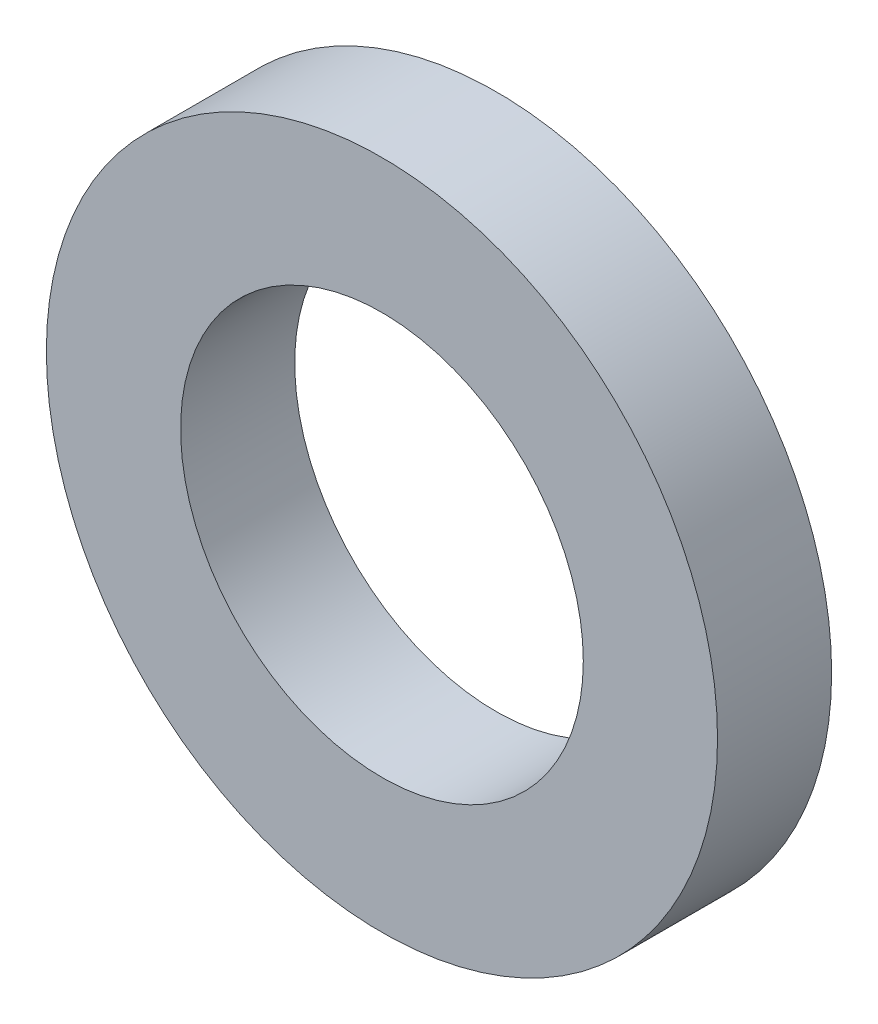
from build123d import *

# Parameters (mm, degrees)
SKETCH1_R           = 5
SKETCH1_R_2         = 3
BOSS_EXTRUDE1_DEPTH = 1.7


with BuildPart() as part:
    # Sketch1 → Boss-Extrude1 (new body)
    with BuildSketch(Plane.XY):
        Circle(SKETCH1_R)
        Circle(SKETCH1_R_2, mode=Mode.SUBTRACT)
    extrude(amount=BOSS_EXTRUDE1_DEPTH)


solid = part.part
